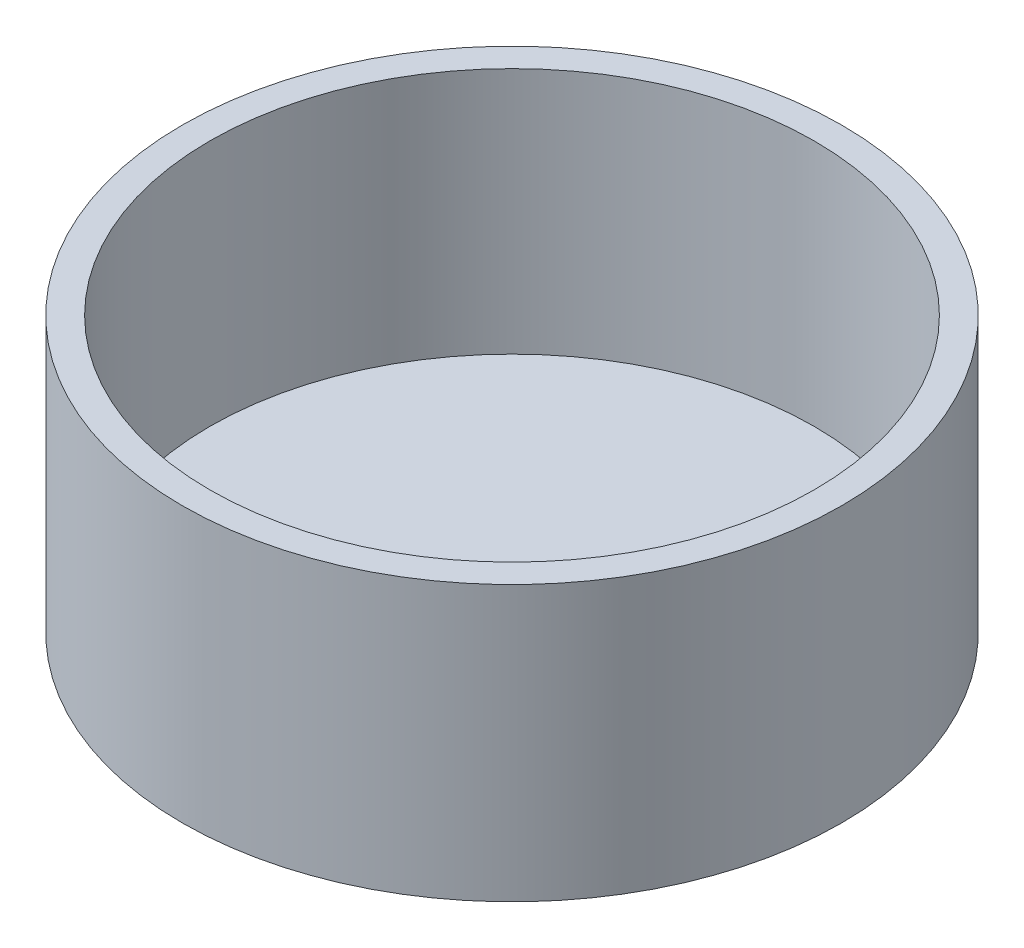
from build123d import *

# Parameters (mm, degrees)
SKETCH1_R           = 152.4
SKETCH1_R_2         = 139.7
BOSS_EXTRUDE2_DEPTH = 127
SKETCH1_7_R         = 139.7
BOSS_EXTRUDE3_DEPTH = 12.7


with BuildPart() as part:
    # Sketch1 → Boss-Extrude2 (new body)
    with BuildSketch(Plane(origin=(0, 0, 0), x_dir=(1, 0, 0), z_dir=(0, 1, 0))):
        Circle(SKETCH1_R)
        Circle(SKETCH1_R_2, mode=Mode.SUBTRACT)
    extrude(amount=BOSS_EXTRUDE2_DEPTH)

    # Sketch1<7> → Boss-Extrude3 (add)
    with BuildSketch(Plane(origin=(0, 0, 0), x_dir=(1, 0, 0), z_dir=(0, 1, 0))):
        Circle(SKETCH1_7_R)
    extrude(amount=BOSS_EXTRUDE3_DEPTH)


solid = part.part
